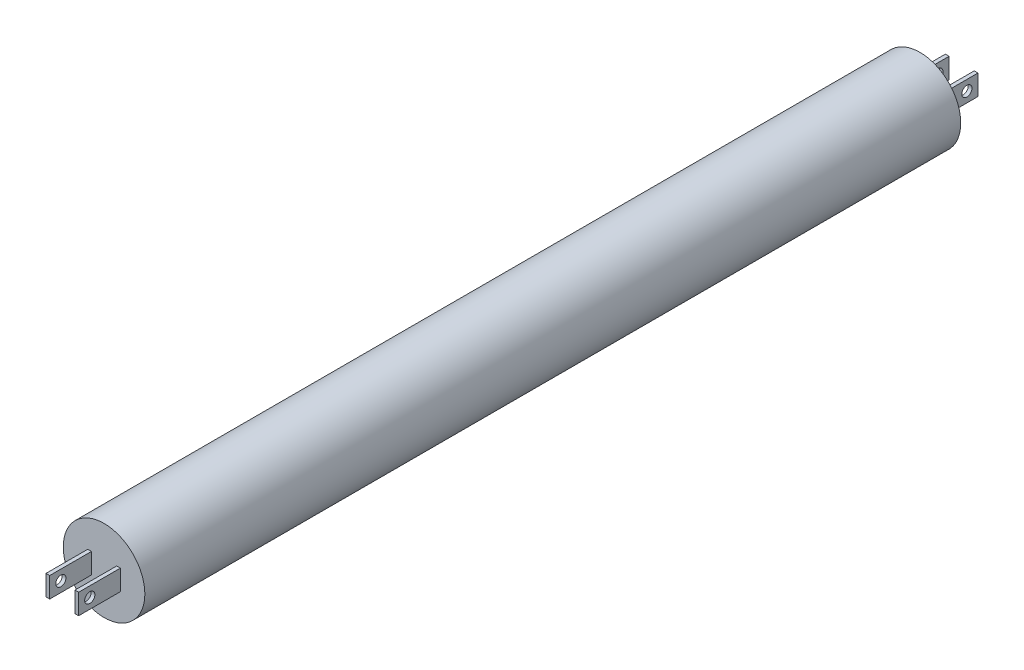
from build123d import *

# Parameters (mm, degrees)
SKETCH1_R           = 20
BOSS_EXTRUDE1_DEPTH = 200
SKETCH2_W           = 1.819488692
SKETCH2_H           = 20.46
BOSS_EXTRUDE2_DEPTH = 5
SKETCH3_R           = 2.5
CUT_EXTRUDE1_DEPTH  = 9


with BuildPart() as part:
    # Sketch1 → Boss-Extrude1 (new, symmetric)
    with BuildSketch(Plane.XY):
        Circle(SKETCH1_R)
    extrude(amount=BOSS_EXTRUDE1_DEPTH, both=True)

    # Sketch2 → Boss-Extrude2 (add, symmetric)
    with BuildSketch(Plane(origin=(0, 0, 0), x_dir=(1, 0, 0), z_dir=(0, 1, 0))):
        with Locations((7.090255654, -210.23)):
            Rectangle(SKETCH2_W, SKETCH2_H)
        with Locations((-7.090255654, -210.23)):
            Rectangle(SKETCH2_W, SKETCH2_H)
        with Locations((7.090255654, 210.23)):
            Rectangle(SKETCH2_W, SKETCH2_H)
        with Locations((-7.090255654, 210.23)):
            Rectangle(SKETCH2_W, SKETCH2_H)
    extrude(amount=BOSS_EXTRUDE2_DEPTH, both=True)

    # Sketch3 → Cut-Extrude1 (cut, symmetric)
    with BuildSketch(Plane(origin=(0, 0, 0), x_dir=(0, 0, -1), z_dir=(1, 0, 0))):
        with Locations((-215, 0)):
            Circle(SKETCH3_R)
        with Locations(Location((215, 0, 0), (0, 0, 180))):
            Circle(SKETCH3_R)
    extrude(amount=CUT_EXTRUDE1_DEPTH, both=True, mode=Mode.SUBTRACT)


solid = part.part
